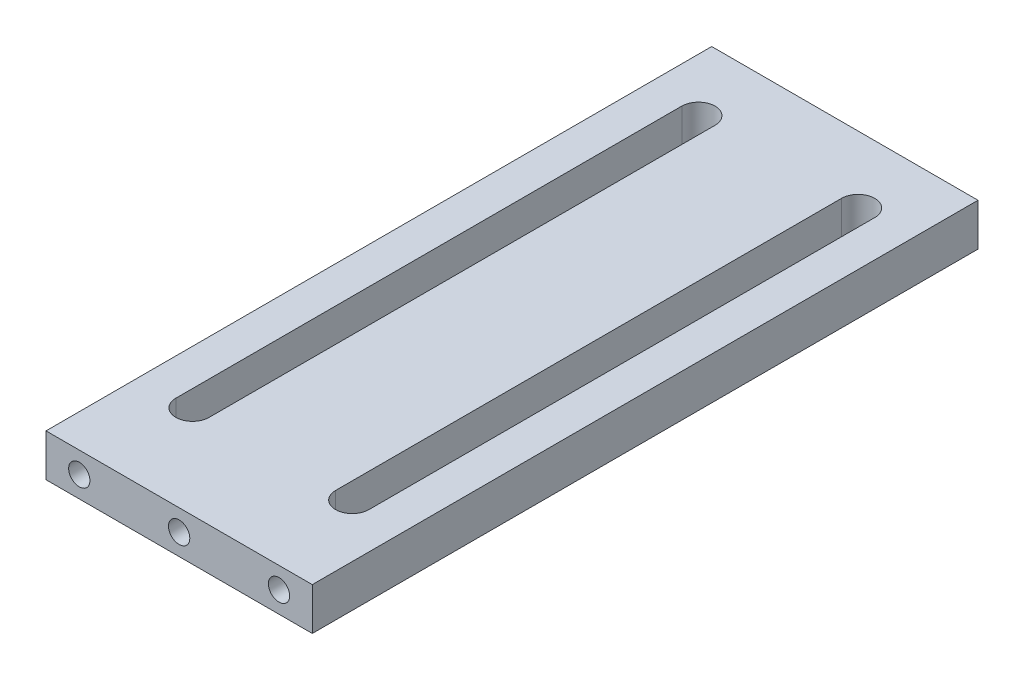
from build123d import *

# Parameters (mm, degrees)
SKETCH1_W           = 20
SKETCH1_H           = 50
BOSS_EXTRUDE1_DEPTH = 3.18
CUT_EXTRUDE1_DEPTH  = 54.94545764
SKETCH3_R           = 0.8
CUT_EXTRUDE2_DEPTH  = 4


with BuildPart() as part:
    # Sketch1 → Boss-Extrude1 (new body)
    with BuildSketch(Plane(origin=(0, 0, 0), x_dir=(1, 0, 0), z_dir=(0, 1, 0))):
        with Locations((10, 25)):
            Rectangle(SKETCH1_W, SKETCH1_H)
    extrude(amount=BOSS_EXTRUDE1_DEPTH)

    # Sketch2 → Cut-Extrude1 (cut, through all)
    with BuildSketch(Plane(origin=(0, 3.18, 0), x_dir=(1, 0, 0), z_dir=(0, 1, 0))):
        with BuildLine():
            Line((2.75, 7), (2.75, 45))
            ThreePointArc((2.75, 45), (4, 46.25), (5.25, 45))
            Line((5.25, 45), (5.25, 7))
            ThreePointArc((5.25, 7), (4, 5.75), (2.75, 7))
        make_face()
    cut_extrude1 = extrude(amount=-CUT_EXTRUDE1_DEPTH, mode=Mode.SUBTRACT)

    # Mirror1: Cut-Extrude1 across plane
    add(cut_extrude1.mirror(Plane(origin=(10, 0, 0), x_dir=(0, 0, 1), z_dir=(1, 0, 0))), mode=Mode.SUBTRACT)

    # Sketch3 → Cut-Extrude2 (cut)
    with BuildSketch(Plane.XY):
        with Locations((10, 1.59)):
            Circle(SKETCH3_R)
        with Locations((2.5, 1.59)):
            Circle(SKETCH3_R)
        with Locations((17.5, 1.59)):
            Circle(SKETCH3_R)
    extrude(amount=-CUT_EXTRUDE2_DEPTH, mode=Mode.SUBTRACT)


solid = part.part
